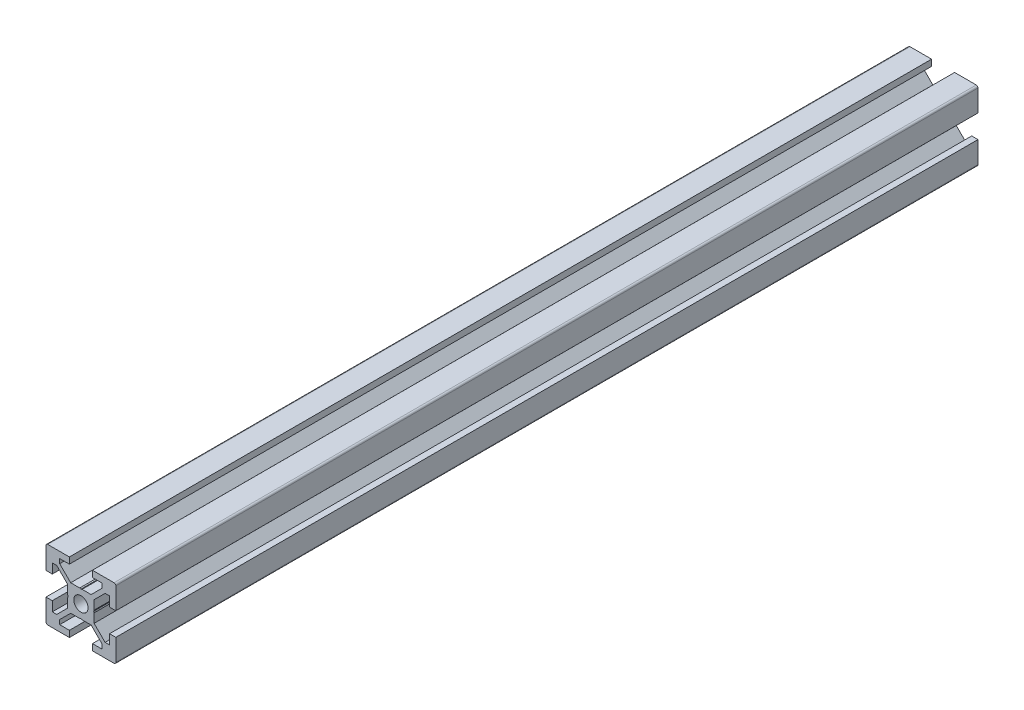
from build123d import *

# Parameters (mm, degrees)
SKETCH1_R           = 2.05
BOSS_EXTRUDE1_DEPTH = 247
FILLET1_R           = 0.5


with BuildPart() as part:
    # Sketch1 → Boss-Extrude1 (new body)
    with BuildSketch(Plane.XY):
        Polygon((-3.3, 10), (-3.3, 8.2), (-6.08, 8.2), (-6.08, 6.928528137), (-2.931471863, 3.78), (-0.34, 3.78), (0, 3.66), (0.34, 3.78), (2.931471863, 3.78), (6.08, 6.928528137), (6.08, 8.2), (3.3, 8.2), (3.3, 10), (10, 10), (10, 3.3), (8.2, 3.3), (8.2, 6.08), (6.928528137, 6.08), (3.78, 2.931471863), (3.78, 0.34), (3.66, 0), (3.78, -0.34), (3.78, -2.931471863), (6.928528137, -6.08), (8.2, -6.08), (8.2, -3.3), (10, -3.3), (10, -10), (3.3, -10), (3.3, -8.2), (6.08, -8.2), (6.08, -6.928528137), (2.931471863, -3.78), (0.34, -3.78), (0, -3.66), (-0.34, -3.78), (-2.931471863, -3.78), (-6.08, -6.928528137), (-6.08, -8.2), (-3.3, -8.2), (-3.3, -10), (-10, -10), (-10, -3.3), (-8.2, -3.3), (-8.2, -6.08), (-6.928528137, -6.08), (-3.78, -2.931471863), (-3.78, -0.34), (-3.66, 0), (-3.78, 0.34), (-3.78, 2.931471863), (-6.928528137, 6.08), (-8.2, 6.08), (-8.2, 3.3), (-10, 3.3), (-10, 10), align=None)
        Circle(SKETCH1_R, mode=Mode.SUBTRACT)
    extrude(amount=BOSS_EXTRUDE1_DEPTH)

    # Fillet1
    fillet1_edges = [part.edges().sort_by_distance(p)[0] for p in [
        (10, 10, 123.5),
        (10, -10, 123.5),
        (-10, -10, 123.5),
        (-10, 10, 123.5),
    ]]
    fillet(fillet1_edges, radius=FILLET1_R)


solid = part.part
